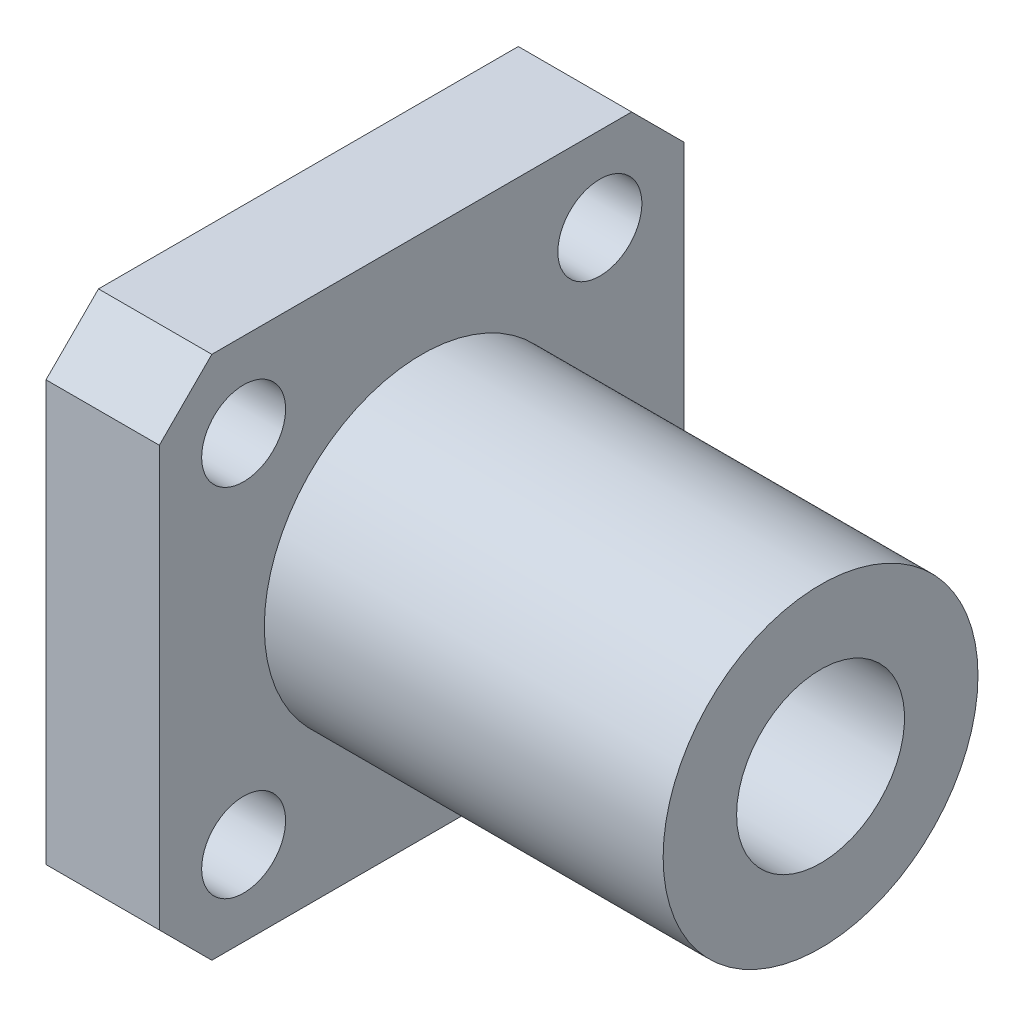
from build123d import *

# Parameters (mm, degrees)
SKETCH1_R           = 4
SKETCH1_R_2         = 2
BOSS_EXTRUDE1_DEPTH = 5.4
SKETCH2_R           = 7.5
SKETCH2_R_2         = 4
BOSS_EXTRUDE2_DEPTH = 19


with BuildPart() as part:
    # Sketch1 → Boss-Extrude1 (new body)
    with BuildSketch(Plane(origin=(0, 0, 0), x_dir=(0, 0, -1), z_dir=(1, 0, 0))):
        Polygon((-12.5, 10), (-10, 12.5), (10, 12.5), (12.5, 10), (12.5, -10), (10, -12.5), (-10, -12.5), (-12.5, -10), align=None)
        with Locations(Location((0, 0, 0), (0, 0, 180))):
            Circle(SKETCH1_R, mode=Mode.SUBTRACT)
        with Locations(Location((8.485281374, 8.485281374, 0), (0, 0, 180))):
            Circle(SKETCH1_R_2, mode=Mode.SUBTRACT)
        with Locations(Location((8.485281374, -8.485281374, 0), (0, 0, 180))):
            Circle(SKETCH1_R_2, mode=Mode.SUBTRACT)
        with Locations(Location((-8.485281374, -8.485281374, 0), (0, 0, 180))):
            Circle(SKETCH1_R_2, mode=Mode.SUBTRACT)
        with Locations(Location((-8.485281374, 8.485281374, 0), (0, 0, 180))):
            Circle(SKETCH1_R_2, mode=Mode.SUBTRACT)
    extrude(amount=BOSS_EXTRUDE1_DEPTH)

    # Sketch2 → Boss-Extrude2 (add)
    with BuildSketch(Plane(origin=(5.4, 0, 0), x_dir=(0, 0, -1), z_dir=(1, 0, 0))):
        with Locations(Location((0, 0, 0), (0, 0, 180))):
            Circle(SKETCH2_R)
        with Locations(Location((0, 0, 0), (0, 0, 180))):
            Circle(SKETCH2_R_2, mode=Mode.SUBTRACT)
    extrude(amount=BOSS_EXTRUDE2_DEPTH)


solid = part.part
